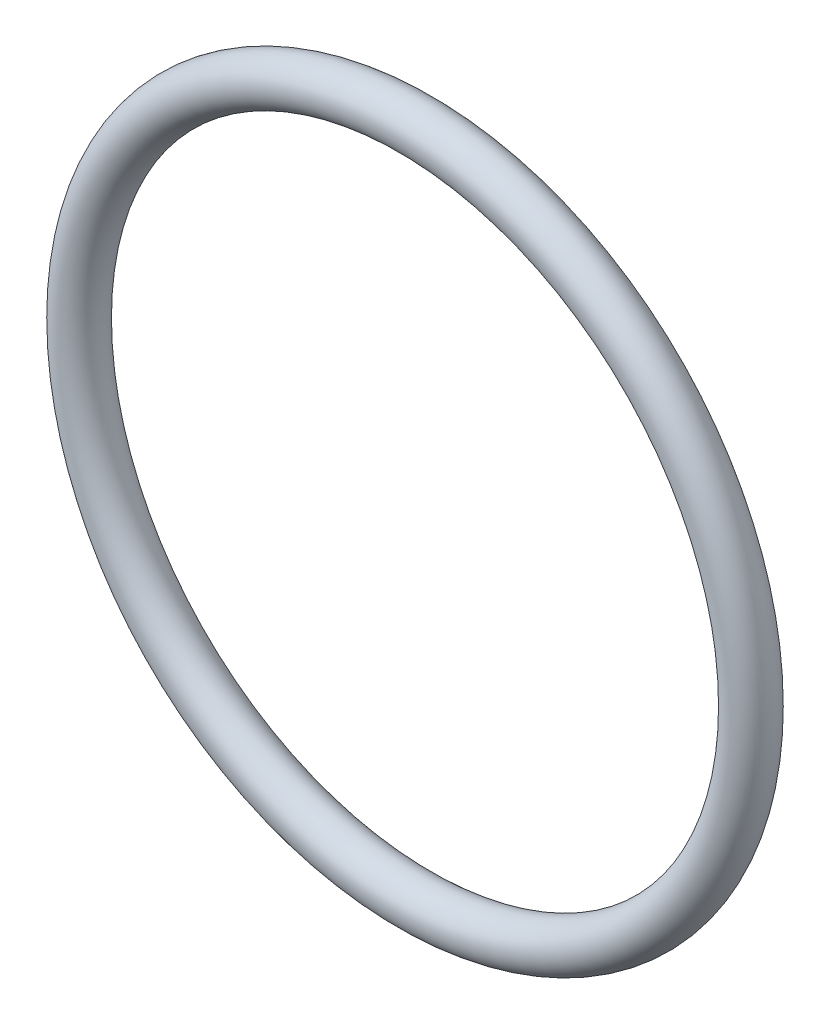
from build123d import *

# Parameters (mm, degrees)
SKETCH2_R = 1.5


with BuildPart() as part:
    # Sketch2 → Revolve1 (revolve)
    with BuildSketch(Plane(origin=(0, 0, 0), x_dir=(0, 0, -1), z_dir=(1, 0, 0)), mode=Mode.PRIVATE) as revolve1_sk:
        with Locations((0, 22)):
            Circle(SKETCH2_R)
    revolve(revolve1_sk.sketch.rotate(Axis((0, 0, 0), (0, 0, 1)), 90), axis=Axis((0, 0, 0), (0, 0, 1)))


solid = part.part
